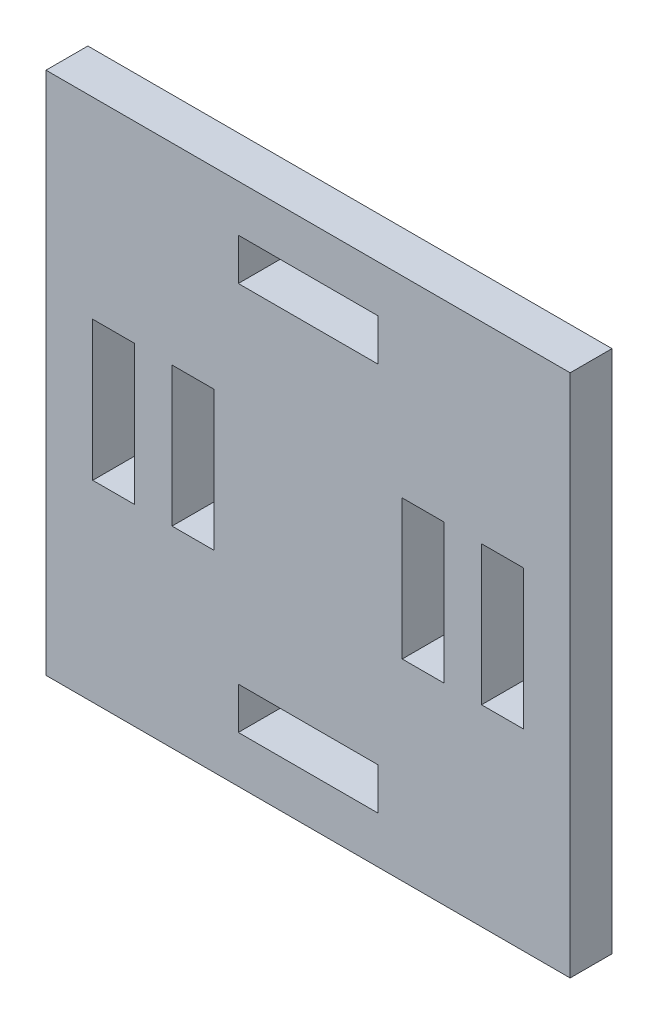
from build123d import *

# Parameters (mm, degrees)
SKETCH1_W                 = 37.57
SKETCH1_H                 = 37.57
SKETCH1_W_2               = 3
SKETCH1_H_2               = 3
SKETCH1_H_3               = 5
PLATE_THICKNESS_3MM_DEPTH = 3
SKETCH_1_W                = 3
SKETCH_1_H                = 0.35
SKETCH_1_W_2              = 0.35
SKETCH_1_H_2              = 3.026917622
SKETCH_1_H_3              = 3
CUT_EXTRUDE_1_DEPTH       = 3
SKETCH_1_2_W              = 0.35
SKETCH_1_2_H              = 3
SKETCH_1_2_W_2            = 3
SKETCH_1_2_H_2            = 0.35
EXTRUDE_1_DEPTH           = 3
SKETCH_2_W                = 3
SKETCH_2_H                = 3.5
SKETCH_2_H_2              = 2.5
SKETCH_2_W_2              = 3.5
SKETCH_2_H_3              = 3
CUT_EXTRUDE_2_DEPTH       = 3


with BuildPart() as part:
    # Sketch1 → Plate_thickness_3mm (new body)
    with BuildSketch(Plane.XY):
        Rectangle(SKETCH1_W, SKETCH1_H)
        with Locations((0, -14.285)):
            Rectangle(SKETCH1_W_2, SKETCH1_H_2, mode=Mode.SUBTRACT)
        with Locations((14.285, 0)):
            Rectangle(SKETCH1_W_2, SKETCH1_H_2, mode=Mode.SUBTRACT)
        with Locations((-14.285, 0)):
            Rectangle(SKETCH1_W_2, SKETCH1_H_2, mode=Mode.SUBTRACT)
        with Locations((-8.25, 0)):
            Rectangle(SKETCH1_W_2, SKETCH1_H_3, mode=Mode.SUBTRACT)
        with Locations((0, 14.285)):
            Rectangle(SKETCH1_W_2, SKETCH1_H_2, mode=Mode.SUBTRACT)
        with Locations((8.25, 0)):
            Rectangle(SKETCH1_W_2, SKETCH1_H_3, mode=Mode.SUBTRACT)
    extrude(amount=PLATE_THICKNESS_3MM_DEPTH)

    # 草图1 → 切除-拉伸1 (cut)
    with BuildSketch(Plane.XY.offset(3)):
        with Locations((0, 12.61)):
            Rectangle(SKETCH_1_W, SKETCH_1_H)
        with Locations((-12.61, -0.013458811)):
            Rectangle(SKETCH_1_W_2, SKETCH_1_H_2)
        with Locations((12.61, -0.013458811)):
            Rectangle(SKETCH_1_W_2, SKETCH_1_H_2)
        with Locations((0, -12.61)):
            Rectangle(SKETCH_1_W, SKETCH_1_H)
        with Locations((-15.61, 0)):
            Rectangle(SKETCH_1_W_2, SKETCH_1_H_3)
        with Locations((0, 15.61)):
            Rectangle(SKETCH_1_W, SKETCH_1_H)
        with Locations((15.61, 0)):
            Rectangle(SKETCH_1_W_2, SKETCH_1_H_3)
        with Locations((0, -15.61)):
            Rectangle(SKETCH_1_W, SKETCH_1_H)
    extrude(amount=-CUT_EXTRUDE_1_DEPTH, mode=Mode.SUBTRACT)

    # 草图1<2> → 凸台-拉伸1 (add)
    with BuildSketch(Plane.XY.offset(3)):
        with Locations((-15.61, 0)):
            Rectangle(SKETCH_1_2_W, SKETCH_1_2_H)
        with Locations((0, 15.61)):
            Rectangle(SKETCH_1_2_W_2, SKETCH_1_2_H_2)
        with Locations((15.61, 0)):
            Rectangle(SKETCH_1_2_W, SKETCH_1_2_H)
        with Locations((0, -15.61)):
            Rectangle(SKETCH_1_2_W_2, SKETCH_1_2_H_2)
    extrude(amount=-EXTRUDE_1_DEPTH)

    # 草图2 → 切除-拉伸2 (cut)
    with BuildSketch(Plane.XY.offset(3)):
        with Locations((-13.935, 3.25)):
            Rectangle(SKETCH_2_W, SKETCH_2_H)
        with Locations((-8.25, 3.75)):
            Rectangle(SKETCH_2_W, SKETCH_2_H_2)
        with Locations((-8.25, -3.75)):
            Rectangle(SKETCH_2_W, SKETCH_2_H_2)
        Polygon((-12.785, -1.5), (-15.435, -1.5), (-15.435, -5), (-12.435, -5), (-12.435, -1.526917622), (-12.785, -1.526917622), align=None)
        with Locations((-3.25, 13.935)):
            Rectangle(SKETCH_2_W_2, SKETCH_2_H_3)
        with Locations((3.25, 13.935)):
            Rectangle(SKETCH_2_W_2, SKETCH_2_H_3)
        with Locations((8.25, 3.75)):
            Rectangle(SKETCH_2_W, SKETCH_2_H_2)
        with Locations((13.935, 3.25)):
            Rectangle(SKETCH_2_W, SKETCH_2_H)
        Polygon((12.785, -1.526917622), (12.435, -1.526917622), (12.435, -5), (15.435, -5), (15.435, -1.5), (12.785, -1.5), align=None)
        with Locations((8.25, -3.75)):
            Rectangle(SKETCH_2_W, SKETCH_2_H_2)
        with Locations((3.25, -13.935)):
            Rectangle(SKETCH_2_W_2, SKETCH_2_H_3)
        with Locations((-3.25, -13.935)):
            Rectangle(SKETCH_2_W_2, SKETCH_2_H_3)
    extrude(amount=-CUT_EXTRUDE_2_DEPTH, mode=Mode.SUBTRACT)


solid = part.part
